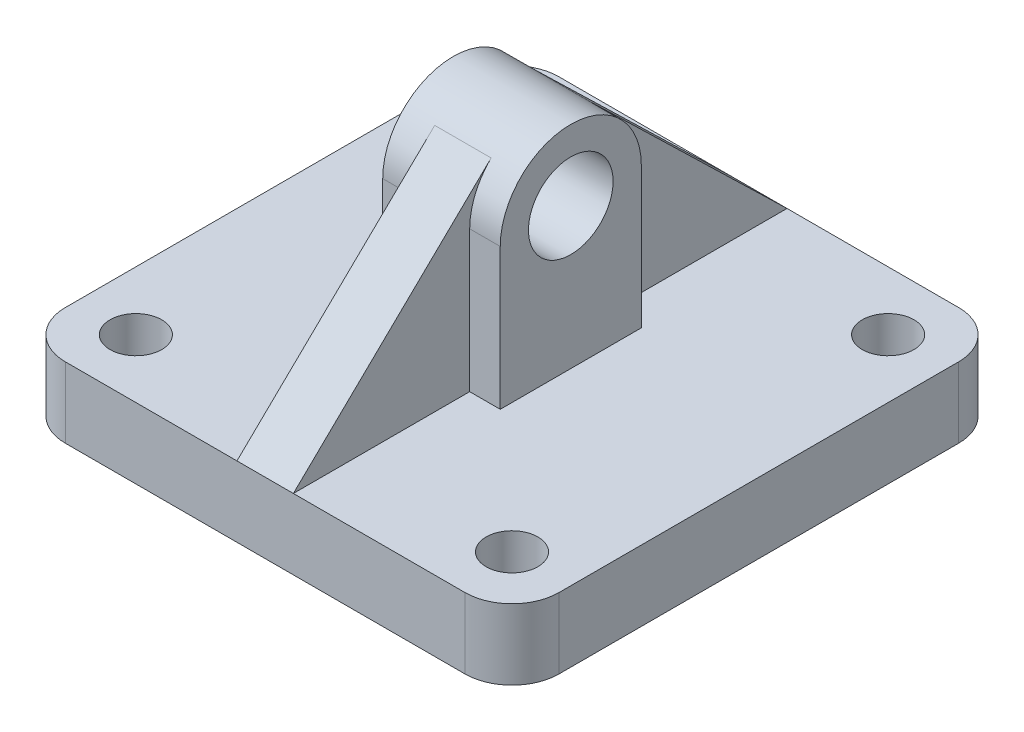
from build123d import *

# Parameters (mm, degrees)
SKETCH_1_R          = 5.5
EXTRUDE_1_DEPTH     = 15
SKETCH_2_R          = 35
CUT_EXTRUDE_1_DEPTH = 10
SKETCH_3_R          = 10
CUT_EXTRUDE_2_DEPTH = 18.58835
SKETCH_5_R          = 9
EXTRUDE_2_DEPTH     = 12.5
EXTRUDE_3_DEPTH     = 6


with BuildPart() as part:
    # Эскиз1 → Бобышка-Вытянуть1 (new body)
    with BuildSketch(Plane(origin=(0, 0, 0), x_dir=(1, 0, 0), z_dir=(0, 1, 0))):
        with BuildLine():
            Line((42.5, -52.5), (-42.5, -52.5))
            ThreePointArc((-42.5, -52.5), (-49.571067812, -49.571067812), (-52.5, -42.5))
            Line((-52.5, -42.5), (-52.5, 42.5))
            ThreePointArc((-52.5, 42.5), (-49.571067812, 49.571067812), (-42.5, 52.5))
            Line((-42.5, 52.5), (42.5, 52.5))
            ThreePointArc((42.5, 52.5), (49.571067812, 49.571067812), (52.5, 42.5))
            Line((52.5, 42.5), (52.5, -42.5))
            ThreePointArc((52.5, -42.5), (49.571067812, -49.571067812), (42.5, -52.5))
        make_face()
        with Locations(Location((-40, -40, 0), (0, 0, 270))):
            Circle(SKETCH_1_R, mode=Mode.SUBTRACT)
        with Locations(Location((-40, 40, 0), (0, 0, 270))):
            Circle(SKETCH_1_R, mode=Mode.SUBTRACT)
        with Locations(Location((40, 40, 0), (0, 0, 270))):
            Circle(SKETCH_1_R, mode=Mode.SUBTRACT)
        with Locations(Location((40, -40, 0), (0, 0, 270))):
            Circle(SKETCH_1_R, mode=Mode.SUBTRACT)
    extrude(amount=EXTRUDE_1_DEPTH)

    # Эскиз2 → Вырез-Вытянуть1 (cut)
    with BuildSketch(Plane.XZ):
        with Locations(Location((0, 0, 0), (0, 0, 270))):
            Circle(SKETCH_2_R)
    extrude(amount=-CUT_EXTRUDE_1_DEPTH, mode=Mode.SUBTRACT)

    # Эскиз3 → Вырез-Вытянуть2 (cut)
    with BuildSketch(Plane.XY.offset(-52.5)):
        with Locations((0, -5)):
            Circle(SKETCH_3_R)
    extrude(amount=CUT_EXTRUDE_2_DEPTH, mode=Mode.SUBTRACT)

    # Эскиз5 → Бобышка-Вытянуть2 (add, symmetric)
    with BuildSketch(Plane(origin=(0, 0, 0), x_dir=(0, 0, -1), z_dir=(1, 0, 0))):
        with BuildLine():
            Line((15, 45), (15, 15))
            Line((15, 15), (-15, 15))
            Line((-15, 15), (-15, 45))
            ThreePointArc((-15, 45), (0, 60), (15, 45))
        make_face()
        with Locations((0, 45)):
            Circle(SKETCH_5_R, mode=Mode.SUBTRACT)
    extrude(amount=EXTRUDE_2_DEPTH, both=True)

    # Эскиз7 → Бобышка-Вытянуть3 (add, symmetric)
    with BuildSketch(Plane(origin=(0, 0, 0), x_dir=(0, 0, -1), z_dir=(1, 0, 0))):
        Polygon((52.5, 15), (10.44023047, 55.770403323), (10.44023047, 15), align=None)
        Polygon((-52.5, 15), (-10.44023047, 55.770403323), (-10.44023047, 15), align=None)
    extrude(amount=EXTRUDE_3_DEPTH, both=True)


solid = part.part
